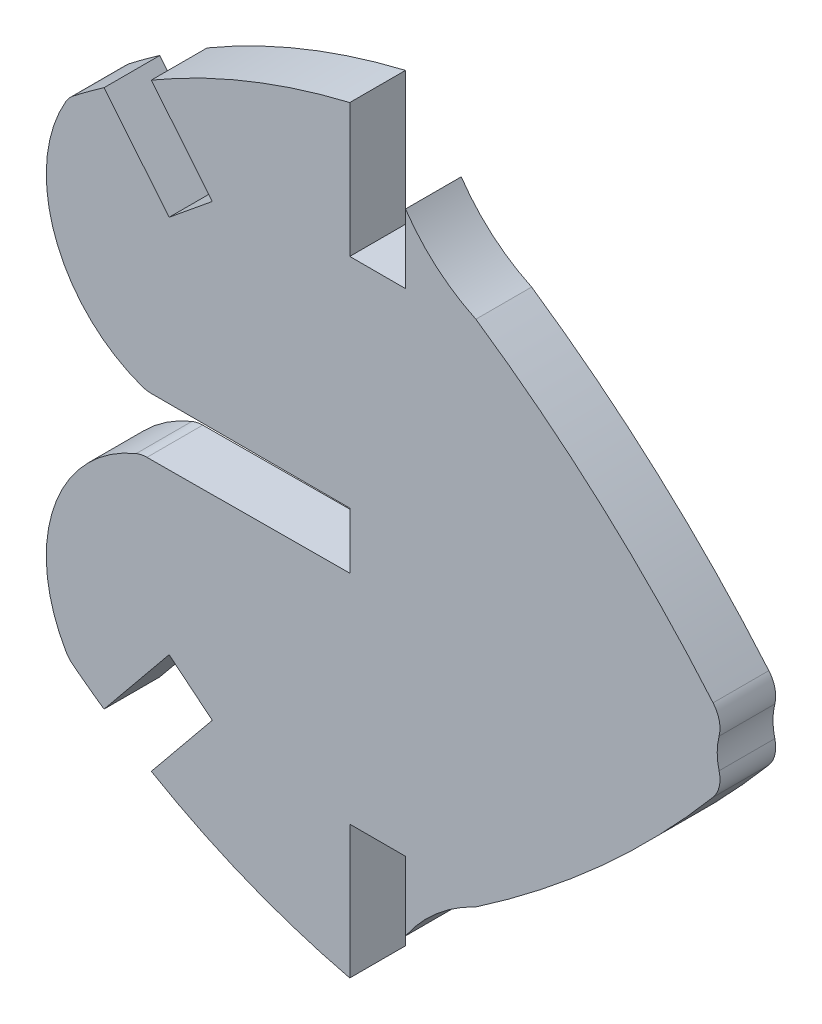
from build123d import *

# Parameters (mm, degrees)
BOSS_EXTRUDE1_DEPTH = 1.524


with BuildPart() as part:
    # Sketch1 → Boss-Extrude1 (new body)
    with BuildSketch(Plane.XY):
        with BuildLine():
            Line((70.351759676, -1.540442282), (70.351759676, 0))
            Line((70.351759676, 0), (64.929759758, 0))
            ThreePointArc((64.929759758, 0), (64.792973258, 0.011875), (64.660279583, 0.047144684))
            ThreePointArc((64.660279583, 0.047144684), (62.28963908, 2.412826115), (62.588919113, 5.748514423))
            ThreePointArc((62.588919113, 5.748514423), (62.67763825, 5.871916038), (62.788250891, 5.976146011))
            ThreePointArc((62.788250891, 5.976146011), (63.205809067, 6.291372891), (63.63152168, 6.595497187))
            Line((63.63152168, 6.595497187), (65.410554861, 4.41654898))
            Line((65.410554861, 4.41654898), (66.591058918, 5.380388267))
            Line((66.591058918, 5.380388267), (64.92449722, 7.421582138))
            ThreePointArc((64.92449722, 7.421582138), (67.556403706, 8.712737588), (70.349637054, 9.602603653))
            Line((70.349637054, 9.602603653), (70.349637054, 5.958967549))
            Line((70.349637054, 5.958967549), (71.873637054, 5.958967549))
            Line((71.873637054, 5.958967549), (71.873637054, 7.844356511))
            ThreePointArc((71.873637054, 7.844356511), (72.72464753, 6.890883011), (73.797539642, 6.196452982))
            ThreePointArc((73.797539642, 6.196452982), (77.23855889, 3.495988283), (80.283555852, 0.355746802))
            ThreePointArc((80.283555852, 0.355746802), (80.451041219, 0.021581778), (80.447017019, -0.35218475))
            ThreePointArc((80.447017019, -0.35218475), (80.395843158, -0.762), (80.447017019, -1.17181525))
            ThreePointArc((80.447017019, -1.17181525), (80.451041219, -1.545581778), (80.283555852, -1.879746802))
            ThreePointArc((80.283555852, -1.879746802), (77.23855889, -5.019988283), (73.797539642, -7.720452982))
            ThreePointArc((73.797539642, -7.720452982), (72.72464753, -8.414883011), (71.873637054, -9.368356511))
            Line((71.873637054, -9.368356511), (71.873637054, -7.482967549))
            Line((71.873637054, -7.482967549), (70.349637054, -7.482967549))
            Line((70.349637054, -7.482967549), (70.349637054, -11.126603653))
            ThreePointArc((70.349637054, -11.126603653), (67.556403706, -10.236737588), (64.92449722, -8.945582138))
            Line((64.92449722, -8.945582138), (66.591058918, -6.904388267))
            Line((66.591058918, -6.904388267), (65.410554861, -5.94054898))
            Line((65.410554861, -5.94054898), (63.63152168, -8.119497187))
            ThreePointArc((63.63152168, -8.119497187), (63.205809068, -7.815372891), (62.788250891, -7.500146011))
            ThreePointArc((62.788250891, -7.500146011), (62.67763825, -7.395916038), (62.588919113, -7.272514424))
            ThreePointArc((62.588919113, -7.272514424), (62.262802552, -4.01311856), (64.509301597, -1.629160622))
            ThreePointArc((64.509301597, -1.629160622), (64.654260243, -1.585608721), (64.804850415, -1.570364804))
            Line((64.804850415, -1.570364804), (70.351759676, -1.540442282))
        make_face()
    extrude(amount=BOSS_EXTRUDE1_DEPTH)


solid = part.part
